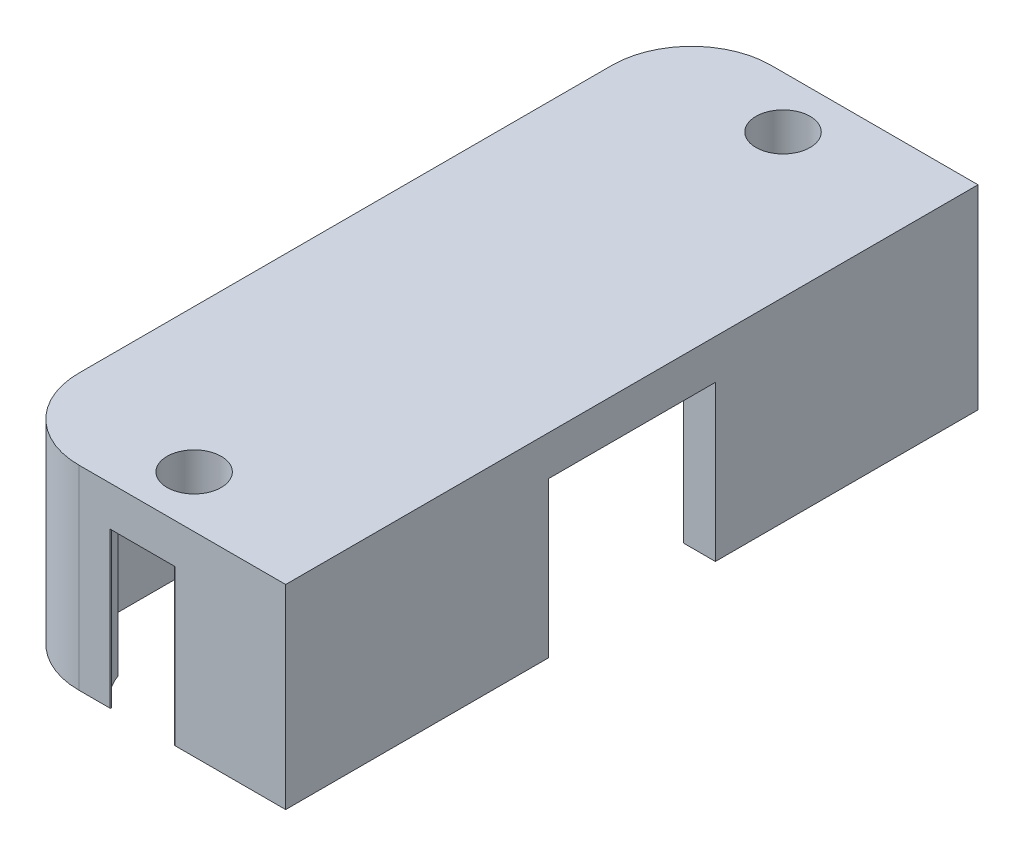
from build123d import *

# Parameters (mm, degrees)
SKETCH1_W            = 18
SKETCH1_H            = 43.5
BOSS_EXTRUDE1_DEPTH  = 2.5
FILLET1_R            = 5
BOSS_EXTRUDE2_DEPTH  = 9.75
SKETCH3_W            = 2
SKETCH3_H            = 14.5
BOSS_EXTRUDE3_DEPTH  = 9.75
M3_CLEARANCE_HOLE1_D = 3.4
SKETCH7_R            = 3.75
CUT_EXTRUDE1_DEPTH   = 26.477931627
FILLET2_R            = 0.05


with BuildPart() as part:
    # Sketch1 → Boss-Extrude1 (new body)
    with BuildSketch(Plane(origin=(0, 0, 0), x_dir=(1, 0, 0), z_dir=(0, 1, 0))):
        Rectangle(SKETCH1_W, SKETCH1_H)
    extrude(amount=BOSS_EXTRUDE1_DEPTH)

    # Fillet1
    fillet1_edges = [part.edges().sort_by_distance(p)[0] for p in [
        (-9, 1.25, -21.75),
        (-9, 1.25, 21.75),
    ]]
    fillet(fillet1_edges, radius=FILLET1_R)

    # Sketch2 → Boss-Extrude2 (add)
    with BuildSketch(Plane.XZ):
        with BuildLine():
            Line((9, -21.75), (-4, -21.75))
            ThreePointArc((-4, -21.75), (-7.535533906, -20.285533906), (-9, -16.75))
            Line((-9, -16.75), (-9, 16.75))
            ThreePointArc((-9, 16.75), (-7.535533906, 20.285533906), (-4, 21.75))
            Line((-4, 21.75), (9, 21.75))
            Line((9, 21.75), (9, 19.75))
            Line((9, 19.75), (-4, 19.75))
            ThreePointArc((-4, 19.75), (-6.121320344, 18.871320344), (-7, 16.75))
            Line((-7, 16.75), (-7, -16.75))
            ThreePointArc((-7, -16.75), (-6.121320344, -18.871320344), (-4, -19.75))
            Line((-4, -19.75), (9, -19.75))
            Line((9, -19.75), (9, -21.75))
        make_face()
    extrude(amount=BOSS_EXTRUDE2_DEPTH)

    # Sketch3 → Boss-Extrude3 (add)
    with BuildSketch(Plane.XZ):
        with Locations((8, 12.5)):
            Rectangle(SKETCH3_W, SKETCH3_H)
        with Locations((8, -12.5)):
            Rectangle(SKETCH3_W, SKETCH3_H)
    extrude(amount=BOSS_EXTRUDE3_DEPTH)

    # M3 Clearance Hole1 (through all)
    with Locations(Plane(origin=(0, 2.5, 0), x_dir=(1, 0, 0), z_dir=(0, 1, 0))):
        with Locations((0, -18.5), (0, 18.5)):
            Hole(M3_CLEARANCE_HOLE1_D / 2)

    # Sketch7 → Cut-Extrude1 (cut, through all)
    with BuildSketch(Plane.XZ):
        with Locations((0, 18.5)):
            Circle(SKETCH7_R)
        with Locations((0, -18.5)):
            Circle(SKETCH7_R)
    extrude(amount=CUT_EXTRUDE1_DEPTH, mode=Mode.SUBTRACT)

    # Fillet2
    fillet2_edges = [part.edges().sort_by_distance(p)[0] for p in [
        (-1.870828693, -4.875, -21.75),
        (1.870828693, -4.875, -21.75),
        (1.870828693, -4.875, 21.75),
        (-1.870828693, -4.875, 21.75),
    ]]
    fillet(fillet2_edges, radius=FILLET2_R)


solid = part.part
